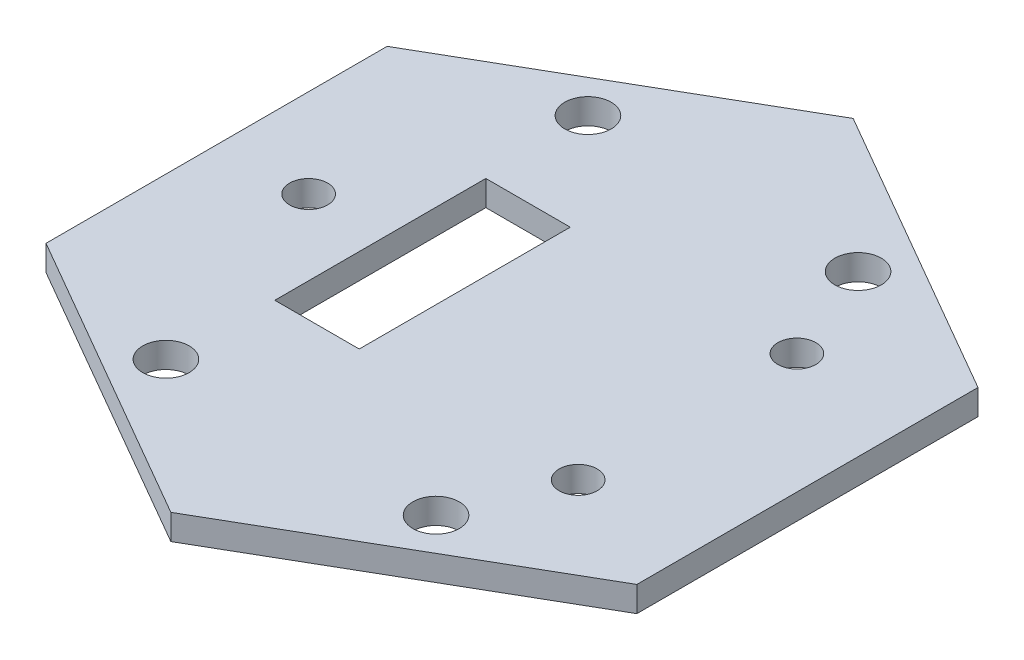
from build123d import *

# Parameters (mm, degrees)
SKETCH1_R           = 2.25
SKETCH1_R_2         = 2.75
SKETCH1_W           = 10
SKETCH1_H           = 25
BOSS_EXTRUDE1_DEPTH = 3


with BuildPart() as part:
    # Sketch1 → Boss-Extrude1 (new body)
    with BuildSketch(Plane(origin=(0, 0, 0), x_dir=(1, 0, 0), z_dir=(0, 1, 0))):
        Polygon((0, -40.414518843), (35, -20.207259422), (35, 20.207259422), (0, 40.414518843), (-35, 20.207259422), (-35, -20.207259422), align=None)
        with Locations(Location((20.792689758, 12.958165481, 0), (0, 0, 270))):
            Circle(SKETCH1_R, mode=Mode.SUBTRACT)
        with Locations(Location((20.794392615, -12.955432674, 0), (0, 0, 270))):
            Circle(SKETCH1_R, mode=Mode.SUBTRACT)
        with Locations(Location((-24.5, 0.406188596, 0), (0, 0, 270))):
            Circle(SKETCH1_R, mode=Mode.SUBTRACT)
        with Locations(Location((-16, 25, 0), (0, 0, 270))):
            Circle(SKETCH1_R_2, mode=Mode.SUBTRACT)
        with Locations(Location((16, 25, 0), (0, 0, 270))):
            Circle(SKETCH1_R_2, mode=Mode.SUBTRACT)
        with Locations(Location((-16, -25, 0), (0, 0, 270))):
            Circle(SKETCH1_R_2, mode=Mode.SUBTRACT)
        with Locations(Location((16, -25, 0), (0, 0, 270))):
            Circle(SKETCH1_R_2, mode=Mode.SUBTRACT)
        with Locations((-10.599366241, 0)):
            Rectangle(SKETCH1_W, SKETCH1_H, mode=Mode.SUBTRACT)
    extrude(amount=BOSS_EXTRUDE1_DEPTH)


solid = part.part
